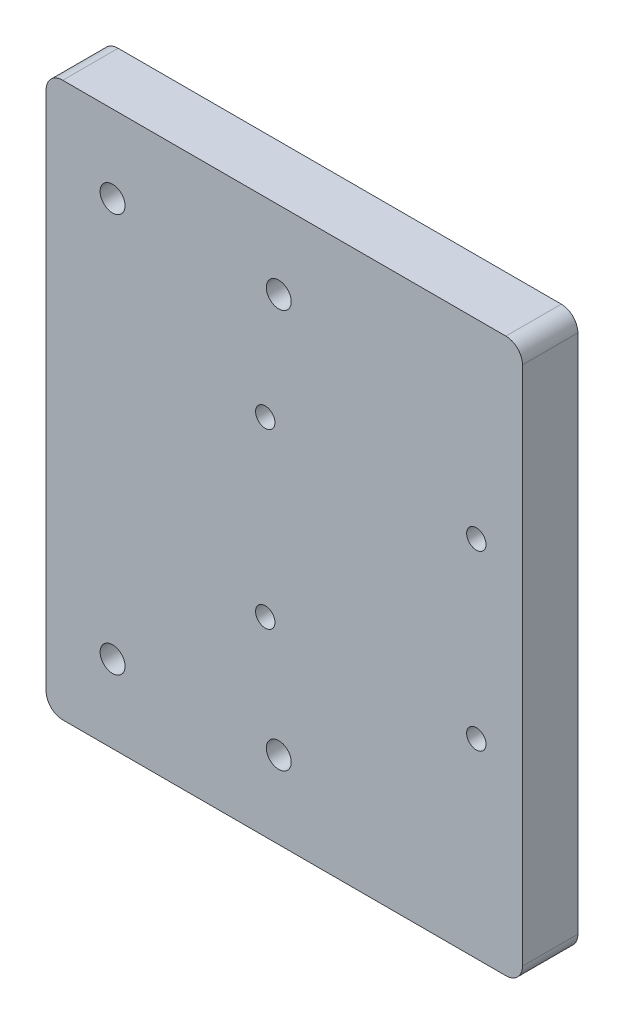
from build123d import *

# Parameters (mm, degrees)
SKETCH1_R             = 2.25
SKETCH1_R_2           = 1.75
PLATE_THICKNESS_DEPTH = 10


with BuildPart() as part:
    # Sketch1 → Plate_thickness (new body)
    with BuildSketch(Plane.XY):
        with BuildLine():
            Line((-43, -47), (-43, 47))
            ThreePointArc((-43, 47), (-42.121320344, 49.121320344), (-40, 50))
            Line((-40, 50), (39.999999985, 50))
            ThreePointArc((39.999999985, 50), (42.121320329, 49.121320344), (42.999999985, 47))
            Line((42.999999985, 47), (42.999999985, -47))
            ThreePointArc((42.999999985, -47), (42.121320329, -49.121320344), (39.999999985, -50))
            Line((39.999999985, -50), (-40, -50))
            ThreePointArc((-40, -50), (-42.121320344, -49.121320344), (-43, -47))
        make_face()
        with Locations((-31, -36)):
            Circle(SKETCH1_R, mode=Mode.SUBTRACT)
        with Locations((-1, -36)):
            Circle(SKETCH1_R, mode=Mode.SUBTRACT)
        with Locations((-3.4375, -15.621)):
            Circle(SKETCH1_R_2, mode=Mode.SUBTRACT)
        with Locations((34.6625, -15.621)):
            Circle(SKETCH1_R_2, mode=Mode.SUBTRACT)
        with Locations((-3.4375, 15.621)):
            Circle(SKETCH1_R_2, mode=Mode.SUBTRACT)
        with Locations((-31, 36)):
            Circle(SKETCH1_R, mode=Mode.SUBTRACT)
        with Locations((-1, 36)):
            Circle(SKETCH1_R, mode=Mode.SUBTRACT)
        with Locations((34.6625, 15.621)):
            Circle(SKETCH1_R_2, mode=Mode.SUBTRACT)
    extrude(amount=PLATE_THICKNESS_DEPTH)


solid = part.part
